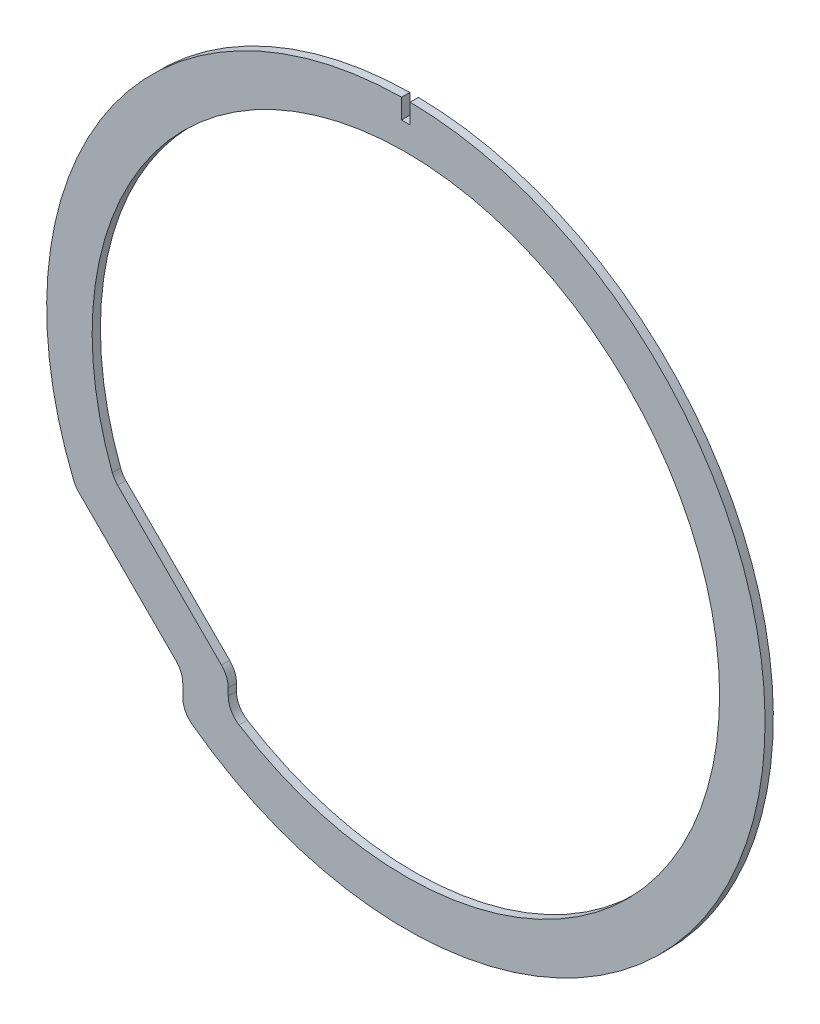
from build123d import *

# Parameters (mm, degrees)
BOSS_EXTRUDE1_DEPTH = 1.5875
CUT_EXTRUDE1_DEPTH  = 3.175
FILLET1_R           = 8.89
CUT_EXTRUDE2_DEPTH  = 212.803448039


with BuildPart() as part:
    # Sketch1 → Boss-Extrude1 (new, symmetric)
    with BuildSketch(Plane.XY):
        with BuildLine():
            Line((-127.293308919, -32.555250036), (-85.984130762, -73.864428193))
            Line((-85.984130762, -73.864428193), (-85.984130762, -86.643760402))
            ThreePointArc((-85.984130762, -86.643760402), (-70.818680903, -97.099597285), (-54.399250036, -105.449308919))
            ThreePointArc((-54.399250036, -105.449308919), (97.88479172, 119.72879172), (-127.293308919, -32.555250036))
        make_face()
    extrude(amount=BOSS_EXTRUDE1_DEPTH, both=True)

    # Sketch2 → Cut-Extrude1 (cut)
    with BuildSketch(Plane.XY.offset(1.5875)):
        with BuildLine():
            Line((-112.423113331, -22.63993873), (-68.458130762, -66.604921299))
            Line((-68.458130762, -66.604921299), (-68.458130762, -77.811715082))
            ThreePointArc((-68.458130762, -77.811715082), (94.55415032, 97.191792757), (-112.423113331, -22.63993873))
        make_face()
    extrude(amount=-CUT_EXTRUDE1_DEPTH, mode=Mode.SUBTRACT)

    # Fillet1
    fillet1_edges = [part.edges().sort_by_distance(p)[0] for p in [
        (-112.423113331, -22.63993873, 0),
        (-68.458130762, -77.811715082, 0),
        (-68.458130762, -66.604921299, 0),
        (-85.984130762, -86.643760402, -0.79375),
        (-85.984130762, -73.864428193, -0.79375),
        (-127.293308919, -32.555250036, -0.79375),
    ]]
    fillet(fillet1_edges, radius=FILLET1_R)

    # Sketch3 → Cut-Extrude2 (cut, through all)
    with BuildSketch(Plane.XY.offset(1.5875)):
        with BuildLine():
            Line((-1.653853322, 152.644117868), (-1.654046603, 160.264117865))
            ThreePointArc((-1.654046603, 160.264117865), (-0.003046821, 160.273999966), (1.647953396, 160.264201621))
            Line((1.647953396, 160.264201621), (1.648146677, 152.644201623))
            Line((1.648146677, 152.644201623), (-1.653853322, 152.644117868))
        make_face()
    extrude(amount=-CUT_EXTRUDE2_DEPTH, mode=Mode.SUBTRACT)


with BuildPart() as cut_extrude2_kept_piece:
    # of the separate pieces the step leaves, the one the design keeps (cut_extrude2_pieces_kept)
    add(part.part.solids().sort_by_distance((-126.058425896, -33.790133059, -1.5875))[0])


solid = cut_extrude2_kept_piece.part
